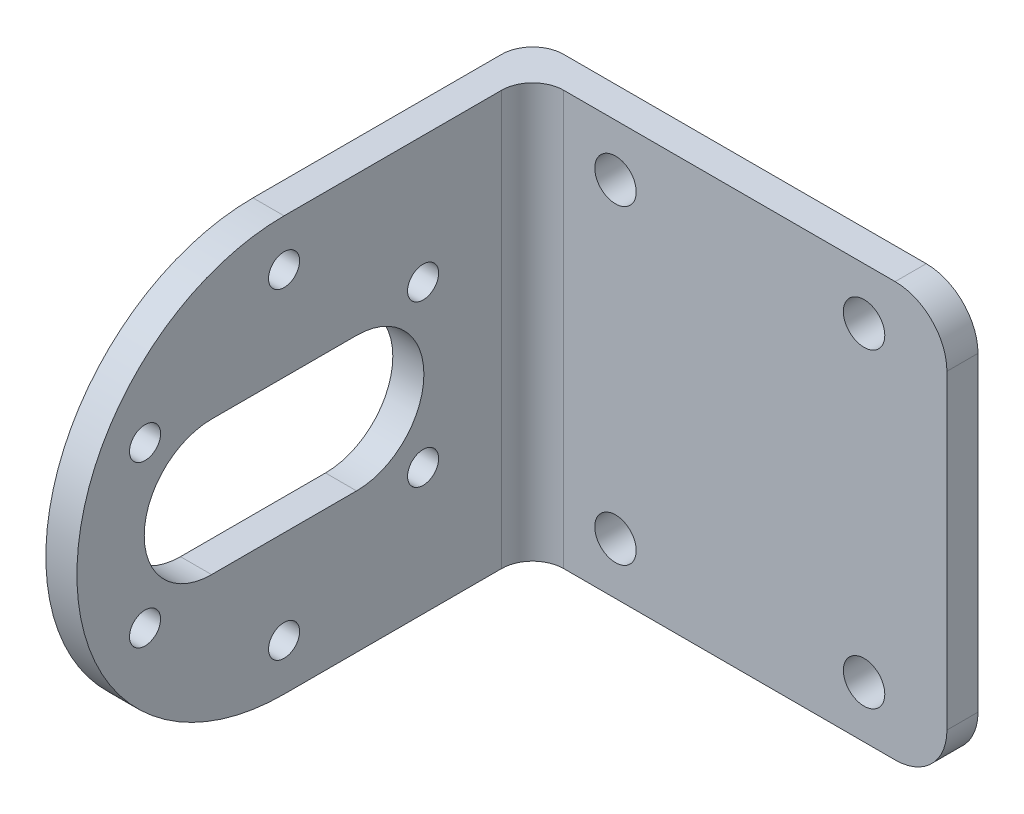
from build123d import *

# Parameters (mm, degrees)
SKETCH_1_W      = 40
SKETCH_1_H      = 40
SKETCH_1_R      = 2
EXTRUDE_1_DEPTH = 3
FILLET_1_R      = 5
SKETCH_2_R      = 1.5
EXTRUDE_2_DEPTH = 3
FILLET_2_R      = 3


with BuildPart() as part:
    # 草图1 → 凸台-拉伸1 (new body)
    with BuildSketch(Plane.XY):
        with Locations((20, 20)):
            Rectangle(SKETCH_1_W, SKETCH_1_H)
        with Locations((8, 35)):
            Circle(SKETCH_1_R, mode=Mode.SUBTRACT)
        with Locations((32, 35)):
            Circle(SKETCH_1_R, mode=Mode.SUBTRACT)
        with Locations((32, 5)):
            Circle(SKETCH_1_R, mode=Mode.SUBTRACT)
        with Locations((8, 5)):
            Circle(SKETCH_1_R, mode=Mode.SUBTRACT)
    extrude(amount=EXTRUDE_1_DEPTH)

    # 圆角1
    fillet_1_edges = [part.edges().sort_by_distance(p)[0] for p in [
        (40, 40, 1.5),
        (40, 0, 1.5),
    ]]
    fillet(fillet_1_edges, radius=FILLET_1_R)

    # 草图2 → 凸台-拉伸2 (add)
    with BuildSketch(Plane.ZY):
        with BuildLine():
            Line((0, 40), (27, 40))
            ThreePointArc((27, 40), (47, 20), (27, 0))
            Line((27, 0), (0, 0))
            Line((0, 0), (0, 40))
        make_face()
        with Locations((27, 35.5)):
            Circle(SKETCH_2_R, mode=Mode.SUBTRACT)
        with Locations((40.423393759, 27.75)):
            Circle(SKETCH_2_R, mode=Mode.SUBTRACT)
        with Locations((40.423393759, 12.25)):
            Circle(SKETCH_2_R, mode=Mode.SUBTRACT)
        with Locations((27, 4.5)):
            Circle(SKETCH_2_R, mode=Mode.SUBTRACT)
        with Locations((13.576606241, 12.25)):
            Circle(SKETCH_2_R, mode=Mode.SUBTRACT)
        with Locations((13.576606241, 27.75)):
            Circle(SKETCH_2_R, mode=Mode.SUBTRACT)
        with BuildLine():
            Line((20, 26.5), (34, 26.5))
            ThreePointArc((34, 26.5), (40.5, 20), (34, 13.5))
            Line((34, 13.5), (20, 13.5))
            ThreePointArc((20, 13.5), (13.5, 20), (20, 26.5))
        make_face(mode=Mode.SUBTRACT)
    extrude(amount=EXTRUDE_2_DEPTH)

    # 圆角2
    fillet_2_edges = [part.edges().sort_by_distance(p)[0] for p in [
        (-3, 20, 0),
        (0, 20, 3),
    ]]
    fillet(fillet_2_edges, radius=FILLET_2_R)


solid = part.part
